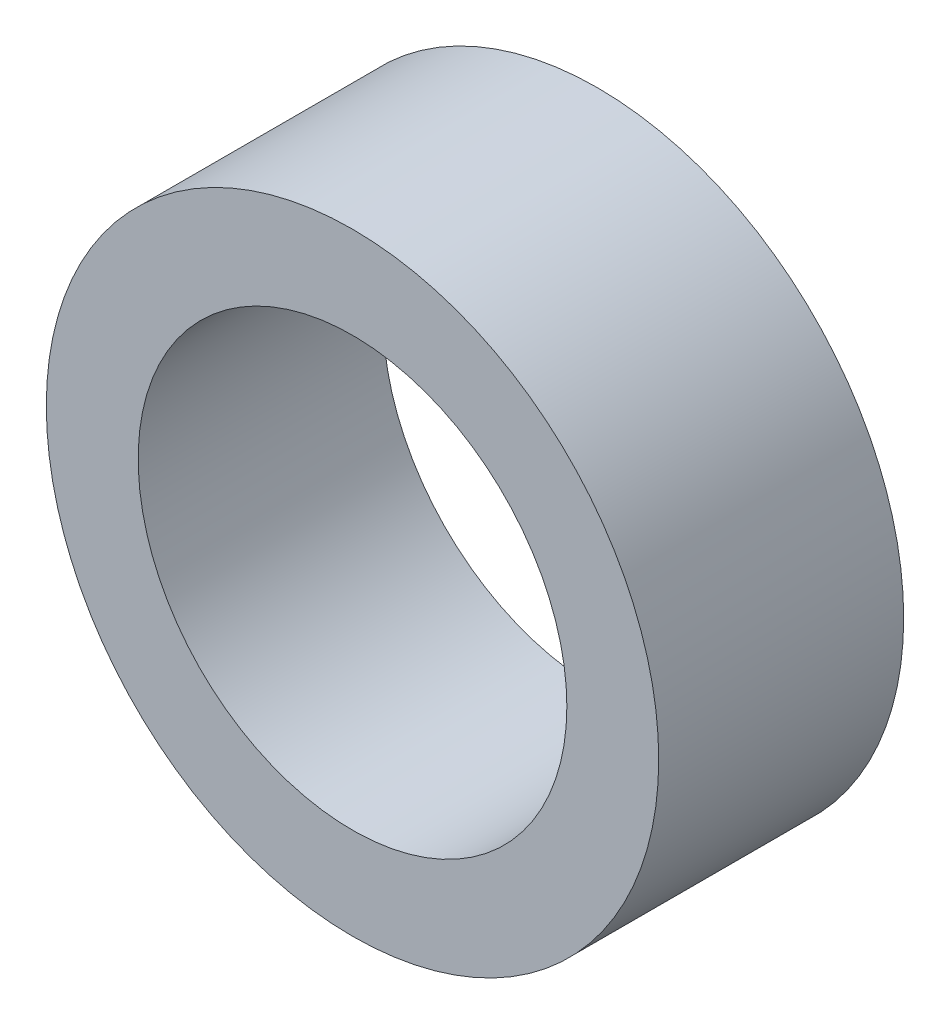
from build123d import *

# Parameters (mm, degrees)
SKETCH1_R           = 50
SKETCH1_R_2         = 35
BOSS_EXTRUDE1_DEPTH = 20


with BuildPart() as part:
    # Sketch1 → Boss-Extrude1 (new body)
    with BuildSketch(Plane.XY):
        Circle(SKETCH1_R)
        Circle(SKETCH1_R_2, mode=Mode.SUBTRACT)
    boss_extrude1 = extrude(amount=BOSS_EXTRUDE1_DEPTH)

    # Mirror1: Boss-Extrude1 across plane
    add(boss_extrude1.mirror(Plane.XY))


solid = part.part
